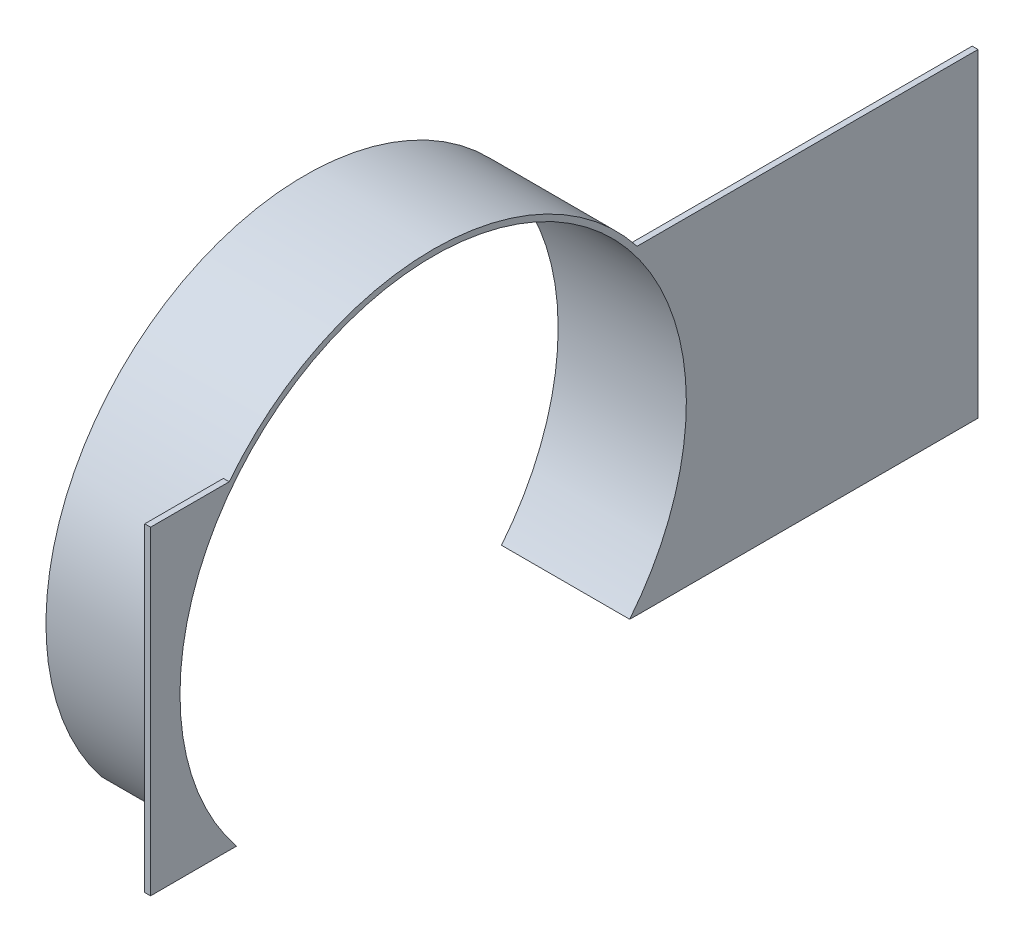
from build123d import *
from build123d.topology import SkipClean

# Parameters (mm, degrees)
BOSS_EXTRUDE1_DEPTH = 42.000000074
BOSS_EXTRUDE4_START = 2.000000064
BOSS_EXTRUDE4_DEPTH = 2.000000064


with BuildPart() as part:
    # Sketch1 → Boss-Extrude1 (new body)
    with BuildSketch(Plane(origin=(0, 0, 0), x_dir=(0, 0, -1), z_dir=(1, 0, 0))):
        with BuildLine():
            Line((-95.033966152, 0.044726877), (-92.443504117, 0.003255065))
            ThreePointArc((-92.443504117, 0.003255065), (-24.995368101, 141.699621751), (42.445929187, 0))
            Line((42.445929187, 0), (45.004045198, 0))
            ThreePointArc((45.004045198, 0), (-24.96907126, 143.699617306), (-95.033966152, 0.044726877))
        make_face()
    extrude(amount=-BOSS_EXTRUDE1_DEPTH)

    # Sketch2 → Boss-Extrude4 (add)
    with SkipClean():  # the faces are left unmerged after this step: merging them gives an invalid solid
        with BuildSketch(Plane(origin=(0, 0, 0), x_dir=(0, 0, -1), z_dir=(1, 0, 0)).offset(BOSS_EXTRUDE4_START)):
            with BuildLine():
                Line((-122.000000064, 0), (-120, 0))
                Line((-120, 0), (-95.033966152, 0.044726877))
                ThreePointArc((-95.033966152, 0.044726877), (-113.897460426, 54.828495951), (-94.998383349, 109.6))
                Line((-94.998383349, 109.6), (-120, 109.6))
                Line((-120, 109.6), (-122.000000064, 109.6))
                Line((-122.000000064, 109.6), (-122.000000064, 0))
            make_face()
            with BuildLine():
                ThreePointArc((-95.033966152, 0.044726877), (-24.937426484, 143.699601567), (44.965014594, -0.049821483))
                Line((44.965014594, -0.049821483), (42.445929187, 0))
                ThreePointArc((42.445929187, 0), (-24.995368101, 141.699621751), (-92.443504117, 0.003255065))
                Line((-92.443504117, 0.003255065), (-95.033966152, 0.044726877))
            make_face()
            with BuildLine():
                Line((50, 109.6), (45.003453118, 109.6))
                ThreePointArc((45.003453118, 109.6), (63.902529422, 54.768457316), (44.965014594, -0.049821483))
                Line((44.965014594, -0.049821483), (160, 0))
                Line((160, 0), (162.000000064, 0))
                Line((162.000000064, 0), (162.000000064, 109.6))
                Line((162.000000064, 109.6), (160, 109.6))
                Line((160, 109.6), (50, 109.6))
            make_face()
        extrude(amount=-BOSS_EXTRUDE4_DEPTH)


solid = part.part
